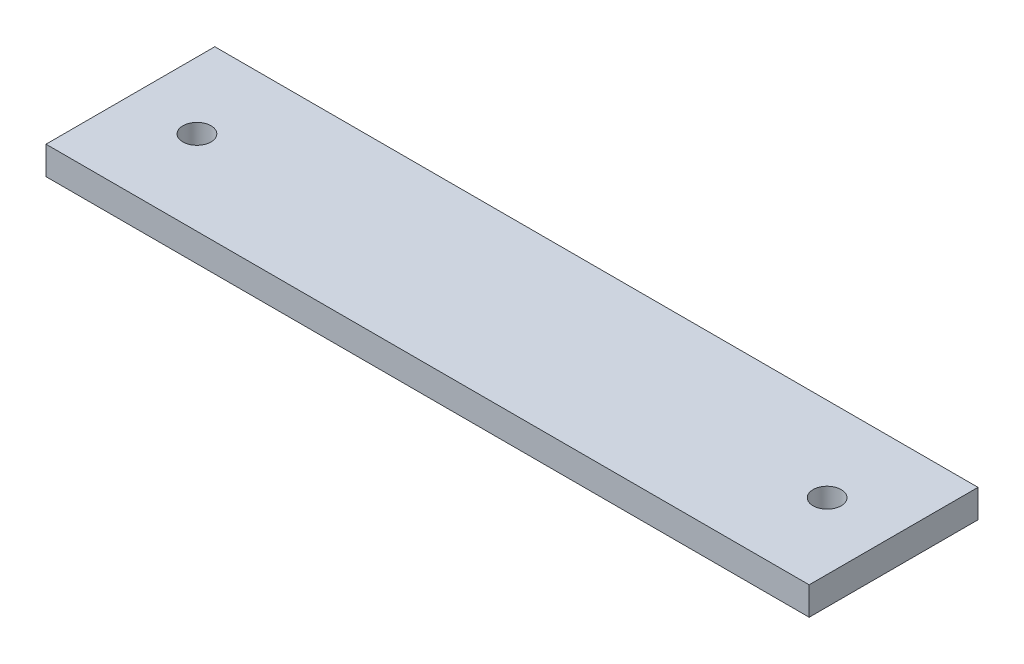
from build123d import *

# Parameters (mm, degrees)
SKETCH1_W           = 172.23994
SKETCH1_H           = 38.1
BOSS_EXTRUDE1_DEPTH = 6.35
CUT_EXTRUDE1_REACH  = 90.43
SKETCH2_R           = 3.175


with BuildPart() as part:
    # Sketch1 → Boss-Extrude1 (new body)
    with BuildSketch(Plane(origin=(0, 0, 0), x_dir=(1, 0, 0), z_dir=(0, 1, 0))):
        Rectangle(SKETCH1_W, SKETCH1_H)
    extrude(amount=BOSS_EXTRUDE1_DEPTH)

    # Sketch2 → Cut-Extrude1 (cut, up to next)
    with BuildSketch(Plane.XZ, mode=Mode.PRIVATE) as cut_extrude1_sk1:
        with Locations(Location((-71.10857, 0, 0), (0, 0, 270))):
            Circle(SKETCH2_R)
    cut_extrude1_tool1 = extrude(cut_extrude1_sk1.sketch, amount=-CUT_EXTRUDE1_REACH, mode=Mode.PRIVATE) & part.part
    # Sketch2 → Cut-Extrude1 (cut, up to next)
    with BuildSketch(Plane.XZ, mode=Mode.PRIVATE) as cut_extrude1_sk2:
        with Locations(Location((71.11997, 0, 0), (0, 0, 270))):
            Circle(SKETCH2_R)
    cut_extrude1_tool2 = extrude(cut_extrude1_sk2.sketch, amount=-CUT_EXTRUDE1_REACH, mode=Mode.PRIVATE) & part.part
    add(cut_extrude1_tool1.solids().sort_by_distance((-71.10857, 0, 0))[0], mode=Mode.SUBTRACT)
    add(cut_extrude1_tool2.solids().sort_by_distance((71.11997, 0, 0))[0], mode=Mode.SUBTRACT)


solid = part.part
